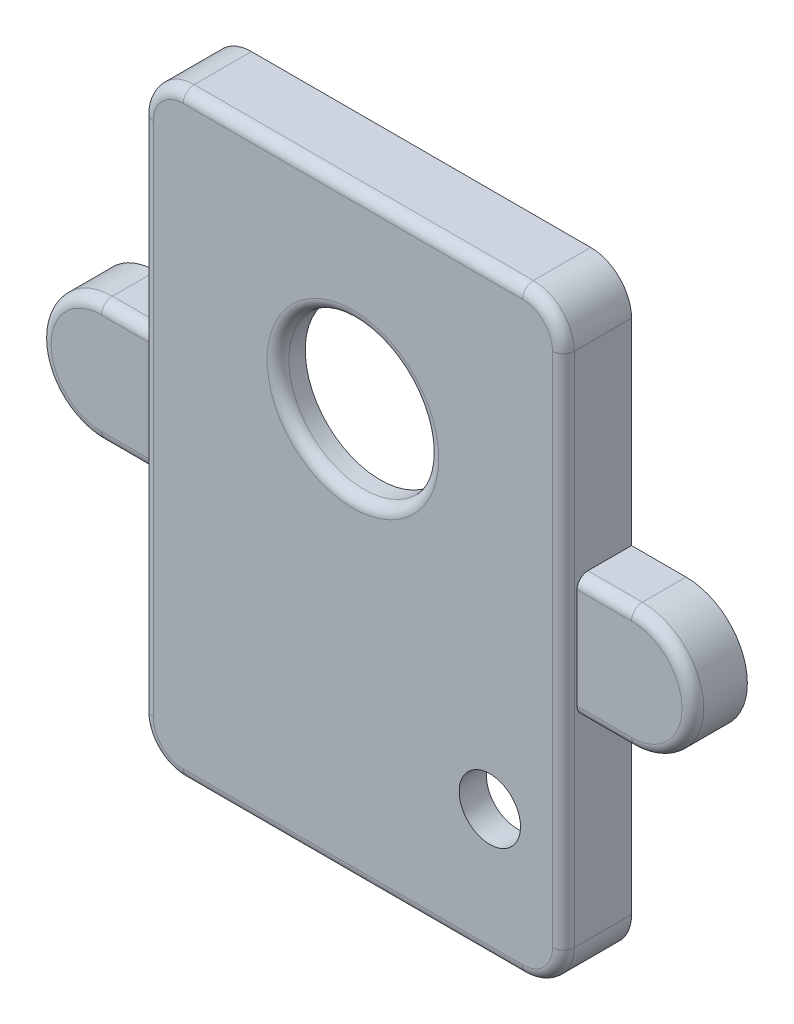
from build123d import *

# Parameters (mm, degrees)
SKETCH1_W           = 30.9
SKETCH1_H           = 43.9
SKETCH1_W_2         = 26.9
SKETCH1_H_2         = 39.9
BOSS_EXTRUDE1_DEPTH = 5
SKETCH2_W           = 30.9
SKETCH2_H           = 43.9
BOSS_EXTRUDE2_DEPTH = 2
BOSS_EXTRUDE3_DEPTH = 4
SKETCH4_R           = 4
CUT_EXTRUDE1_DEPTH  = 2
CUT_EXTRUDE2_DEPTH  = 60.199408781
FILLET1_R           = 3
FILLET2_R           = 0.8
SKETCH6_R           = 2.25
CUT_EXTRUDE3_DEPTH  = 60.199408781


with BuildPart() as part:
    # Sketch1 → Boss-Extrude1 (new body)
    with BuildSketch(Plane.XY):
        with Locations((15.45, 21.95)):
            Rectangle(SKETCH1_W, SKETCH1_H)
        with Locations((15.45, 21.95)):
            Rectangle(SKETCH1_W_2, SKETCH1_H_2, mode=Mode.SUBTRACT)
    extrude(amount=BOSS_EXTRUDE1_DEPTH)

    # Sketch2 → Boss-Extrude2 (add)
    with BuildSketch(Plane.XY.offset(5)):
        with Locations((15.45, 21.95)):
            Rectangle(SKETCH2_W, SKETCH2_H)
    extrude(amount=-BOSS_EXTRUDE2_DEPTH)

    # Sketch3 → Boss-Extrude3 (add)
    with BuildSketch(Plane(origin=(0, 0, 0), x_dir=(-1, 0, 0), z_dir=(0, 0, -1))):
        with BuildLine():
            Line((-34.9, 26.45), (-30.9, 26.45))
            Line((-30.9, 26.45), (-30.9, 17.45))
            Line((-30.9, 17.45), (-34.9, 17.45))
            ThreePointArc((-34.9, 17.45), (-39.4, 21.95), (-34.9, 26.45))
        make_face()
    boss_extrude3 = extrude(amount=-BOSS_EXTRUDE3_DEPTH)

    # Sketch4 → Cut-Extrude1 (cut)
    with BuildSketch(Plane(origin=(0, 0, 0), x_dir=(-1, 0, 0), z_dir=(0, 0, -1))):
        with Locations((-34.9, 21.95)):
            Circle(SKETCH4_R)
    cut_extrude1 = extrude(amount=-CUT_EXTRUDE1_DEPTH, mode=Mode.SUBTRACT)

    # Mirror1: Boss-Extrude3, Cut-Extrude1 across plane
    add(boss_extrude3.mirror(Plane(origin=(15.45, 0, 0), x_dir=(0, 0, 1), z_dir=(1, 0, 0))))
    add(cut_extrude1.mirror(Plane(origin=(15.45, 0, 0), x_dir=(0, 0, 1), z_dir=(1, 0, 0))), mode=Mode.SUBTRACT)

    # Sketch5 → Cut-Extrude2 (cut, through all)
    with BuildSketch(Plane.XY.offset(5)):
        with BuildLine():
            ThreePointArc((20.95, 29.9), (19.339087297, 33.789087297), (15.45, 35.4))
            Line((15.45, 35.4), (15.45, 24.4))
            ThreePointArc((15.45, 24.4), (19.339087297, 26.010912703), (20.95, 29.9))
        make_face()
        with BuildLine():
            Line((15.45, 24.4), (15.45, 35.4))
            ThreePointArc((15.45, 35.4), (9.95, 29.9), (15.45, 24.4))
        make_face()
    extrude(amount=-CUT_EXTRUDE2_DEPTH, mode=Mode.SUBTRACT)

    # Fillet1
    fillet1_edges = [part.edges().sort_by_distance(p)[0] for p in [
        (0, 0, 2.5),
        (0, 43.9, 2.5),
        (30.9, 43.9, 2.5),
        (30.9, 0, 2.5),
    ]]
    fillet(fillet1_edges, radius=FILLET1_R)

    # Fillet2
    fillet2_edges = [part.edges().sort_by_distance(p)[0] for p in [
        (15.45, 0, 5),
        (15.45, 43.9, 5),
        (0, 21.95, 5),
        (0.878679656, 43.021320344, 5),
        (30.021320344, 43.021320344, 5),
        (0.878679656, 0.878679656, 5),
        (30.021320344, 0.878679656, 5),
        (39.4, 21.95, 4),
        (32.9, 26.45, 4),
        (32.9, 17.45, 4),
        (-8.5, 21.95, 4),
        (-2, 17.45, 4),
        (-2, 26.45, 4),
        (15.45, 35.4, 5),
        (30.9, 21.95, 5),
    ]]
    fillet(fillet2_edges, radius=FILLET2_R)

    # Sketch6 → Cut-Extrude3 (cut, through all)
    with BuildSketch(Plane.XY.offset(5)):
        with Locations((25.5, 9.5)):
            Circle(SKETCH6_R)
    extrude(amount=-CUT_EXTRUDE3_DEPTH, mode=Mode.SUBTRACT)


solid = part.part
